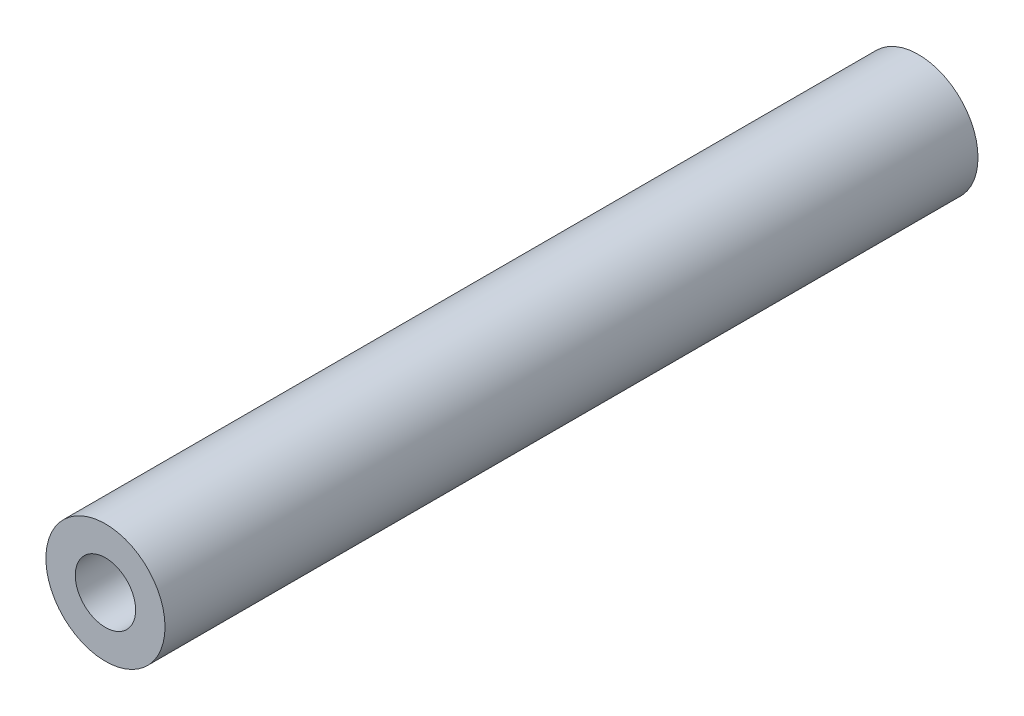
from build123d import *

# Parameters (mm, degrees)
SKETCH1_R           = 1.9558
SKETCH1_R_2         = 0.9906
BOSS_EXTRUDE1_DEPTH = 13.3477


with BuildPart() as part:
    # Sketch1 → Boss-Extrude1 (new, symmetric)
    with BuildSketch(Plane.XY):
        Circle(SKETCH1_R)
        Circle(SKETCH1_R_2, mode=Mode.SUBTRACT)
    extrude(amount=BOSS_EXTRUDE1_DEPTH, both=True)


solid = part.part
